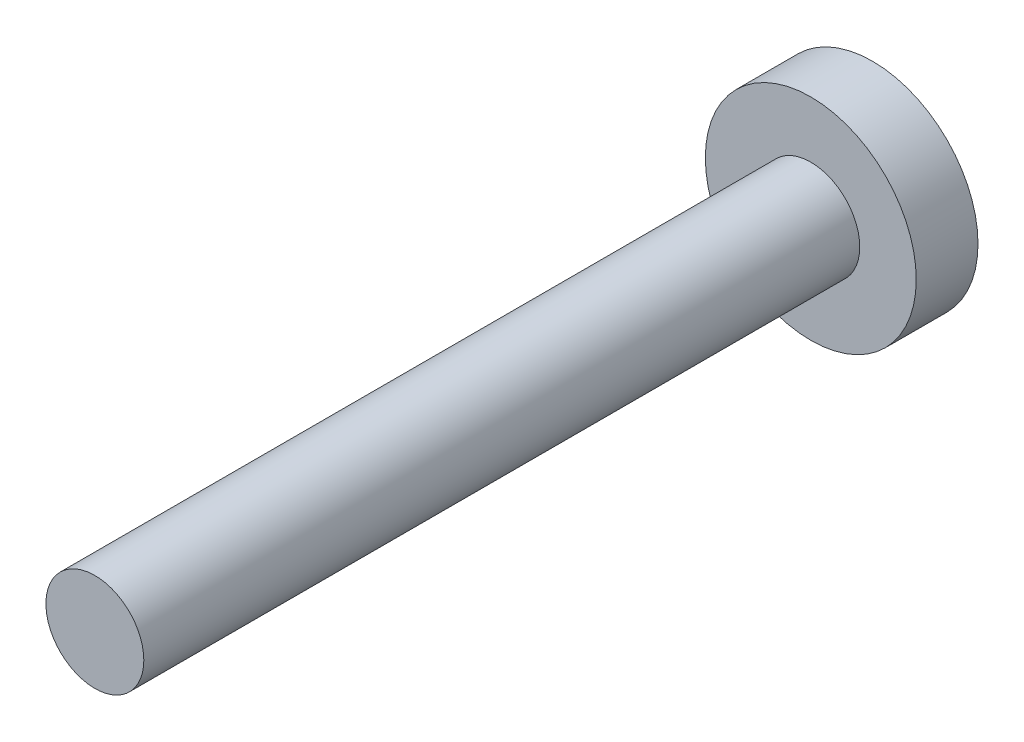
from build123d import *

# Parameters (mm, degrees)
SKETCH1_R           = 6.1125
BOSS_EXTRUDE1_DEPTH = 3.58
SKETCH2_R           = 2.8375
BOSS_EXTRUDE2_DEPTH = 41.5


with BuildPart() as part:
    # Sketch1 → Boss-Extrude1 (new body)
    with BuildSketch(Plane.XY):
        with Locations(Location((0, 0, 0), (0, 0, 180))):
            Circle(SKETCH1_R)
    extrude(amount=BOSS_EXTRUDE1_DEPTH)

    # Sketch2 → Boss-Extrude2 (add)
    with BuildSketch(Plane.XY.offset(3.58)):
        Circle(SKETCH2_R)
    extrude(amount=BOSS_EXTRUDE2_DEPTH)


solid = part.part
